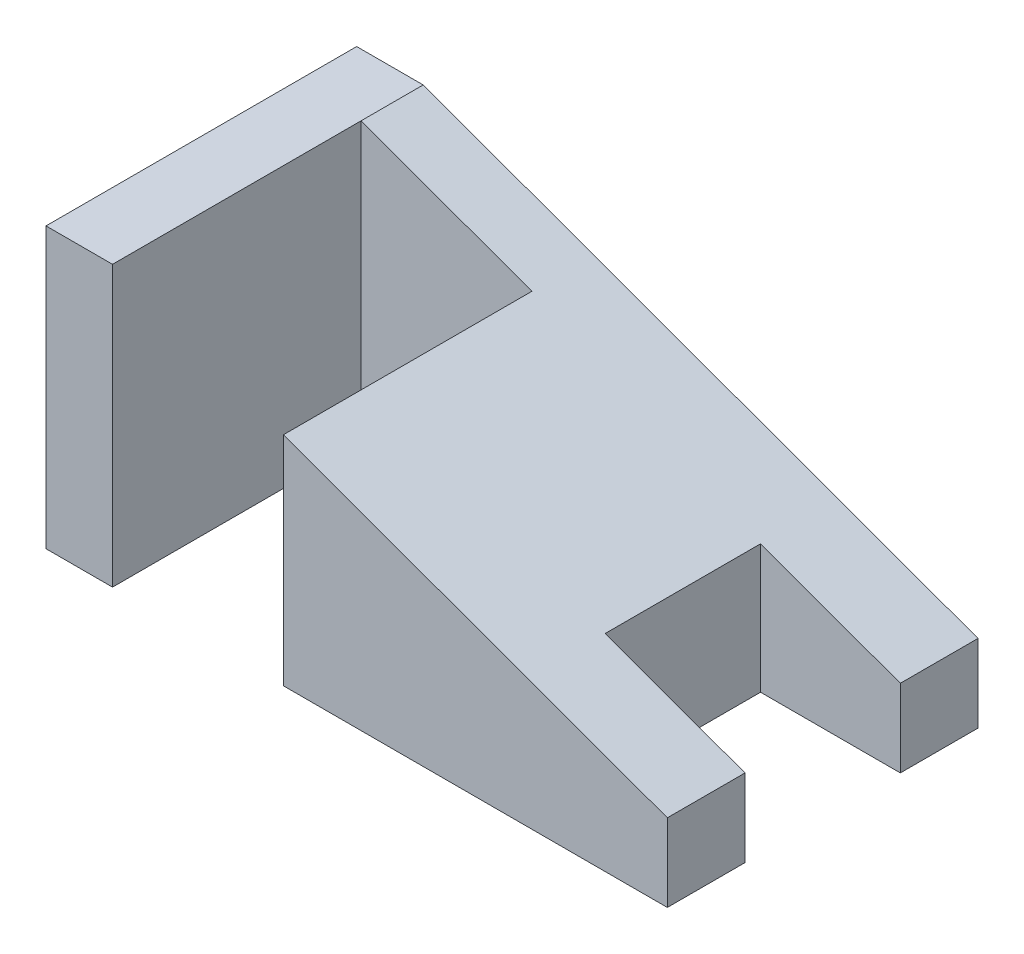
from build123d import *

# Parameters (mm, degrees)
SKETCH1_W           = 21.413967735
SKETCH1_H           = 90
BOSS_EXTRUDE1_DEPTH = 100
CUT_EXTRUDE1_REACH  = 243.039
SKETCH2_W           = 55
SKETCH2_H           = 80
SKETCH2_W_2         = 45
SKETCH2_H_2         = 25


with BuildPart() as part:
    # Sketch1 → Boss-Extrude1 (new body)
    with BuildSketch(Plane.XY):
        with Locations((10.706983867, 45)):
            Rectangle(SKETCH1_W, SKETCH1_H)
        Polygon((200, 0), (200, 25), (21.413967735, 90), (21.413967735, 0), align=None)
    extrude(amount=BOSS_EXTRUDE1_DEPTH)

    # Cut-Extrude1: up to this face of the body (flat: up to its plane)
    cut_extrude1_end = Plane(part.part.faces().sort_by_distance((100, 0, 50))[0])
    # Sketch2 → Cut-Extrude1 (cut, up to the picked face)
    with BuildSketch(Plane(origin=(0, 90, 0), x_dir=(1, 0, 0), z_dir=(0, 1, 0)), mode=Mode.PRIVATE) as cut_extrude1_sk1:
        with Locations((48.913967735, -60)):
            Rectangle(SKETCH2_W, SKETCH2_H)
    cut_extrude1_tool1 = split(extrude(cut_extrude1_sk1.sketch, amount=-CUT_EXTRUDE1_REACH, mode=Mode.PRIVATE), bisect_by=cut_extrude1_end, keep=Keep.BOTH, mode=Mode.PRIVATE)
    # Sketch2 → Cut-Extrude1 (cut, up to the picked face)
    with BuildSketch(Plane(origin=(0, 90, 0), x_dir=(1, 0, 0), z_dir=(0, 1, 0)), mode=Mode.PRIVATE) as cut_extrude1_sk2:
        with Locations((177.5, -37.5)):
            Rectangle(SKETCH2_W_2, SKETCH2_H_2)
    cut_extrude1_tool2 = split(extrude(cut_extrude1_sk2.sketch, amount=-CUT_EXTRUDE1_REACH, mode=Mode.PRIVATE), bisect_by=cut_extrude1_end, keep=Keep.BOTH, mode=Mode.PRIVATE)
    # Sketch2 → Cut-Extrude1 (cut, up to the picked face)
    with BuildSketch(Plane(origin=(0, 90, 0), x_dir=(1, 0, 0), z_dir=(0, 1, 0)), mode=Mode.PRIVATE) as cut_extrude1_sk3:
        with Locations((177.5, -62.5)):
            Rectangle(SKETCH2_W_2, SKETCH2_H_2)
    cut_extrude1_tool3 = split(extrude(cut_extrude1_sk3.sketch, amount=-CUT_EXTRUDE1_REACH, mode=Mode.PRIVATE), bisect_by=cut_extrude1_end, keep=Keep.BOTH, mode=Mode.PRIVATE)
    add(cut_extrude1_tool1.solids().sort_by(Axis((48.913968, 90, 60), (0, -1, 0)))[0], mode=Mode.SUBTRACT)
    add(cut_extrude1_tool2.solids().sort_by(Axis((177.5, 90, 37.5), (0, -1, 0)))[0], mode=Mode.SUBTRACT)
    add(cut_extrude1_tool3.solids().sort_by(Axis((177.5, 90, 62.5), (0, -1, 0)))[0], mode=Mode.SUBTRACT)


solid = part.part
